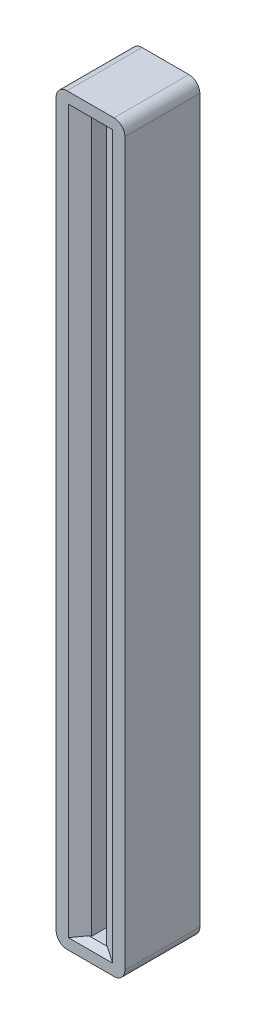
from build123d import *

# Parameters (mm, degrees)
SKETCH2_W          = 10.033
SKETCH2_H          = 108.585
EXTRUDE2_DEPTH     = 10.9474
FILLET1_R          = 1.5875
SKETCH7_W          = 2.159
SKETCH7_H          = 104.14
CUT_EXTRUDE2_DEPTH = 6.731
CHAMFER1_SIZE      = 2.159
CHAMFER1_SIZE2     = 1.246499231
CHAMFER2_SIZE      = 0.635
CHAMFER2_SIZE2     = 1.099852263


with BuildPart() as part:
    # Sketch2 → Extrude2 (new body)
    with BuildSketch(Plane.XY):
        Rectangle(SKETCH2_W, SKETCH2_H)
    extrude(amount=EXTRUDE2_DEPTH)

    # Fillet1
    fillet1_edges = [part.edges().sort_by_distance(p)[0] for p in [
        (-5.0165, 54.2925, 5.4737),
        (5.0165, 54.2925, 5.4737),
        (5.0165, -54.2925, 5.4737),
        (-5.0165, -54.2925, 5.4737),
    ]]
    fillet(fillet1_edges, radius=FILLET1_R)

    # Sketch7 → Cut-Extrude2 (cut)
    with BuildSketch(Plane.XY.offset(10.9474)):
        Rectangle(SKETCH7_W, SKETCH7_H)
    extrude(amount=-CUT_EXTRUDE2_DEPTH, mode=Mode.SUBTRACT)

    # Chamfer1
    chamfer1_edges = [part.edges().sort_by_distance(p)[0] for p in [
        (-1.0795, 0, 10.9474),
        (1.0795, 0, 10.9474),
    ]]
    chamfer1_side = [part.faces().sort_by_distance(p)[0] for p in [
        (0, 53.202024722, 10.9474),
    ]]
    chamfer(chamfer1_edges, length=CHAMFER1_SIZE, length2=CHAMFER1_SIZE2, reference=chamfer1_side[0])

    # Chamfer2
    chamfer2_edges = [part.edges().sort_by_distance(p)[0] for p in [
        (0, 52.07, 10.9474),
        (0, -52.07, 10.9474),
    ]]
    chamfer2_side = [part.faces().sort_by_distance(p)[0] for p in [
        (0, 53.160475278, 10.9474),
    ]]
    chamfer(chamfer2_edges, length=CHAMFER2_SIZE, length2=CHAMFER2_SIZE2, reference=chamfer2_side[0])


solid = part.part
